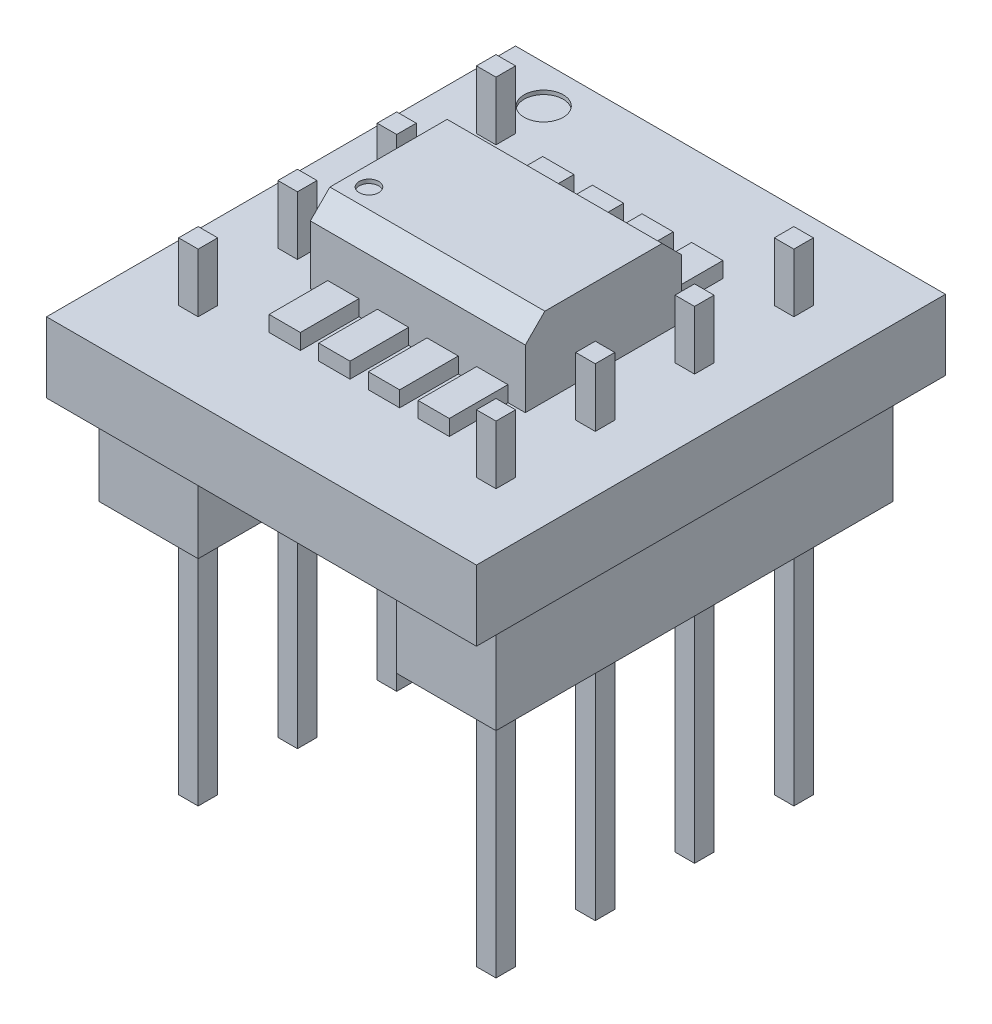
from build123d import *

# Parameters (mm, degrees)
SKETCH1_W           = 11
SKETCH1_H           = 12
BOSS_EXTRUDE1_DEPTH = 1.8
SKETCH2_W           = 2.54
SKETCH2_H           = 10.16
BOSS_EXTRUDE2_DEPTH = 2.54
BOSS_EXTRUDE3_START = -5.84
SKETCH3_W           = 0.5
SKETCH3_H           = 0.5
BOSS_EXTRUDE3_DEPTH = 12.34
SKETCH4_W           = 5.5
SKETCH4_H           = 4
BOSS_EXTRUDE4_DEPTH = 2
CHAMFER1_SIZE       = 0.5
SKETCH5_W           = 0.8
SKETCH5_H           = 7
BOSS_EXTRUDE5_DEPTH = 0.4
SKETCH6_R           = 0.5
CUT_EXTRUDE1_DEPTH  = 0.1
SKETCH7_R           = 0.25
CUT_EXTRUDE2_DEPTH  = 0.1


with BuildPart() as part:
    # Sketch1 → Boss-Extrude1 (new body)
    with BuildSketch(Plane(origin=(0, 0, 0), x_dir=(1, 0, 0), z_dir=(0, 1, 0))):
        Rectangle(SKETCH1_W, SKETCH1_H)
    extrude(amount=BOSS_EXTRUDE1_DEPTH)

    # Sketch2 → Boss-Extrude2 (add)
    with BuildSketch(Plane.XZ):
        with Locations((-3.81, 0)):
            Rectangle(SKETCH2_W, SKETCH2_H)
        with Locations((3.81, 0)):
            Rectangle(SKETCH2_W, SKETCH2_H)
    extrude(amount=BOSS_EXTRUDE2_DEPTH)

    # Sketch3 → Boss-Extrude3 (add)
    with BuildSketch(Plane.XZ.offset(2.54).offset(BOSS_EXTRUDE3_START)):
        with Locations((3.81, 1.27)):
            Rectangle(SKETCH3_W, SKETCH3_H)
        with Locations((3.81, 3.81)):
            Rectangle(SKETCH3_W, SKETCH3_H)
        with Locations((3.81, -1.27)):
            Rectangle(SKETCH3_W, SKETCH3_H)
        with Locations((3.81, -3.81)):
            Rectangle(SKETCH3_W, SKETCH3_H)
    boss_extrude3 = extrude(amount=BOSS_EXTRUDE3_DEPTH)

    # Mirror1: Boss-Extrude3 across plane
    add(boss_extrude3.mirror(Plane(origin=(0, 0, 0), x_dir=(0, 0, 1), z_dir=(1, 0, 0))))

    # Sketch4 → Boss-Extrude4 (add)
    with BuildSketch(Plane(origin=(0, 1.8, 0), x_dir=(1, 0, 0), z_dir=(0, 1, 0))):
        Rectangle(SKETCH4_W, SKETCH4_H)
    extrude(amount=BOSS_EXTRUDE4_DEPTH)

    # Chamfer1
    chamfer1_edges = [part.edges().sort_by_distance(p)[0] for p in [
        (0, 3.8, -2),
        (0, 3.8, 2),
    ]]
    chamfer(chamfer1_edges, length=CHAMFER1_SIZE)

    # Sketch5 → Boss-Extrude5 (add)
    with BuildSketch(Plane(origin=(0, 1.8, 0), x_dir=(1, 0, 0), z_dir=(0, 1, 0))):
        with Locations((-0.635, 0)):
            Rectangle(SKETCH5_W, SKETCH5_H)
        with Locations((-1.905, 0)):
            Rectangle(SKETCH5_W, SKETCH5_H)
        with Locations((0.635, 0)):
            Rectangle(SKETCH5_W, SKETCH5_H)
        with Locations((1.905, 0)):
            Rectangle(SKETCH5_W, SKETCH5_H)
    extrude(amount=BOSS_EXTRUDE5_DEPTH)

    # Sketch6 → Cut-Extrude1 (cut)
    with BuildSketch(Plane(origin=(0, 1.8, 0), x_dir=(1, 0, 0), z_dir=(0, 1, 0))):
        with Locations(Location((-3.81, 5.03, 0), (0, 0, 270))):
            Circle(SKETCH6_R)
    extrude(amount=-CUT_EXTRUDE1_DEPTH, mode=Mode.SUBTRACT)

    # Sketch7 → Cut-Extrude2 (cut)
    with BuildSketch(Plane(origin=(0, 3.8, 0), x_dir=(1, 0, 0), z_dir=(0, 1, 0))):
        with Locations(Location((-2.25, -1, 0), (0, 0, 270))):
            Circle(SKETCH7_R)
    extrude(amount=-CUT_EXTRUDE2_DEPTH, mode=Mode.SUBTRACT)


solid = part.part
